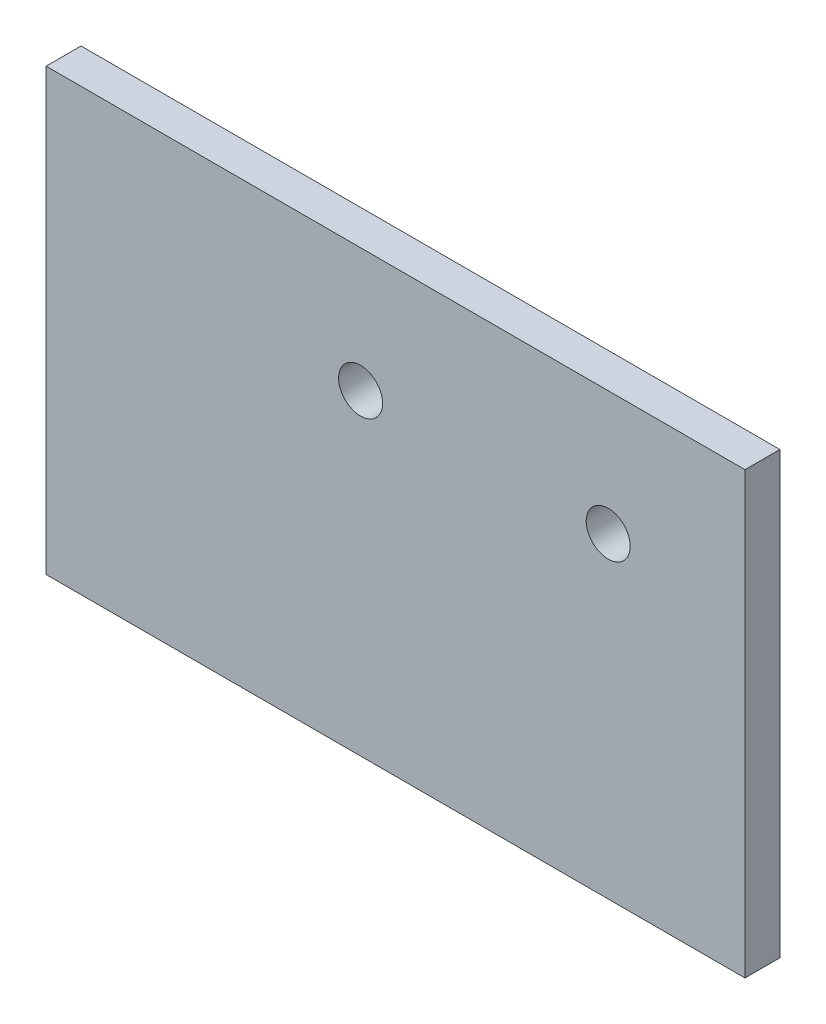
from build123d import *

# Parameters (mm, degrees)
SKETCH1_W           = 127
SKETCH1_H           = 80
SKETCH1_R           = 4.0000047
SKETCH1_R_2         = 4
BOSS_EXTRUDE1_DEPTH = 6.35


with BuildPart() as part:
    # Sketch1 → Boss-Extrude1 (new body)
    with BuildSketch(Plane.XY):
        with Locations((63.5, -40)):
            Rectangle(SKETCH1_W, SKETCH1_H)
        with Locations((57.15, -22.5)):
            Circle(SKETCH1_R, mode=Mode.SUBTRACT)
        with Locations((102.15, -22.5)):
            Circle(SKETCH1_R_2, mode=Mode.SUBTRACT)
    extrude(amount=BOSS_EXTRUDE1_DEPTH)


solid = part.part
